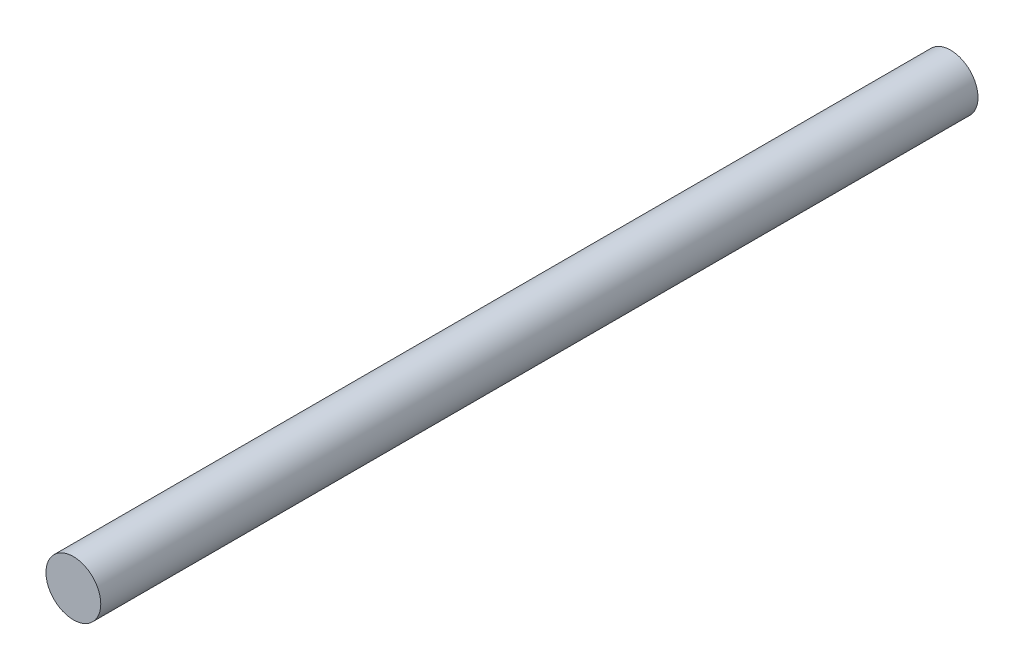
from build123d import *

# Parameters (mm, degrees)
SKETCH1_R           = 3.175
BOSS_EXTRUDE1_DEPTH = 50.8


with BuildPart() as part:
    # Sketch1 → Boss-Extrude1 (new, symmetric)
    with BuildSketch(Plane.XY):
        Circle(SKETCH1_R)
    extrude(amount=BOSS_EXTRUDE1_DEPTH, both=True)


solid = part.part
